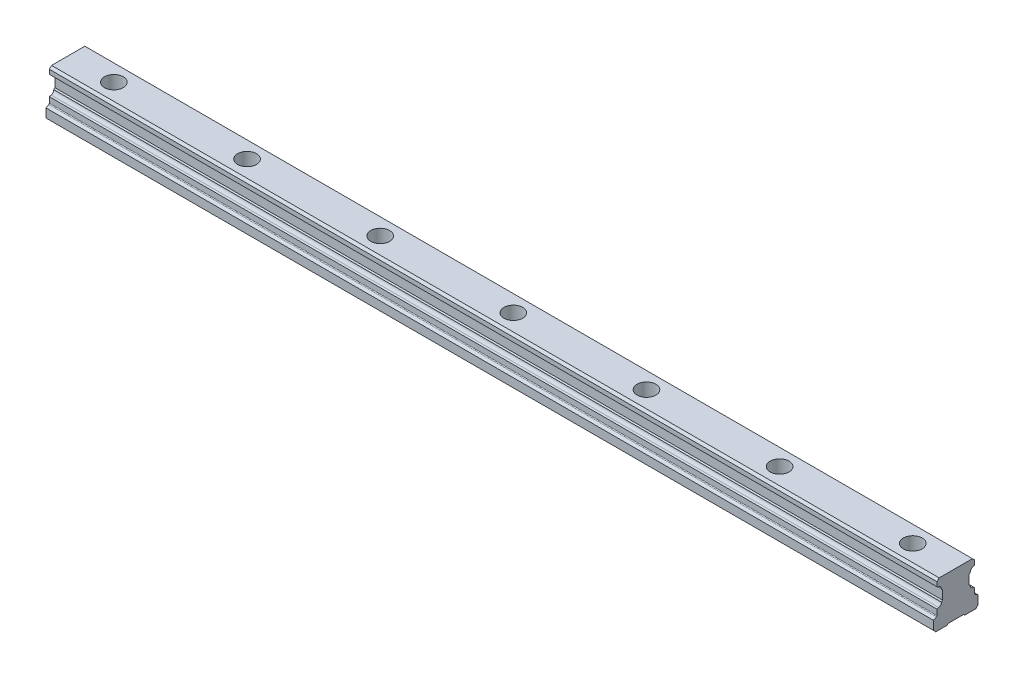
from build123d import *

# Parameters (mm, degrees)
BOSS_EXTRUDE5_DEPTH = 400
SKETCH8_R           = 4.25
CUT_EXTRUDE1_DEPTH  = 9
SKETCH9_R           = 3
CUT_EXTRUDE2_DEPTH  = 459.748231604
LPATTERN1_COUNT     = 20
LPATTERN1_PITCH     = 60


with BuildPart() as part:
    # Sketch7 → Boss-Extrude5 (new body)
    with BuildSketch(Plane(origin=(58.5, 0, 0), x_dir=(0, 0, -1), z_dir=(1, 0, 0))):
        with BuildLine():
            Line((-7.709038211, 8.883084864), (-8.5, 8.601077183))
            Line((-8.5, 8.601077183), (-8.5, 6.104700538))
            ThreePointArc((-8.5, 6.104700538), (-8.566987298, 5.854700538), (-8.75, 5.671687836))
            Line((-8.75, 5.671687836), (-10, 4.95))
            Line((-10, 4.95), (-10, 1))
            Line((-10, 1), (-9, 0))
            Line((-9, 0), (-4, 0))
            Line((-4, 0), (-3.5, 0.5))
            Line((-3.5, 0.5), (3.5, 0.5))
            Line((3.5, 0.5), (4, 0))
            Line((4, 0), (9, 0))
            Line((9, 0), (10, 1))
            Line((10, 1), (10, 4.95))
            Line((10, 4.95), (8.75, 5.671687836))
            ThreePointArc((8.75, 5.671687836), (8.566987298, 5.854700538), (8.5, 6.104700538))
            Line((8.5, 6.104700538), (8.5, 8.46691323))
            Line((8.5, 8.46691323), (8.084678947, 8.882234283))
            ThreePointArc((8.084678947, 8.882234283), (6.941822875, 9.249266637), (6.503340774, 10.366659226))
            Line((6.503340774, 10.366659226), (6, 10.87))
            Line((6, 10.87), (6, 14.93))
            Line((6, 14.93), (6.503340774, 15.433340774))
            ThreePointArc((6.503340774, 15.433340774), (6.813545517, 16.412959034), (7.709038211, 16.916915136))
            Line((7.709038211, 16.916915136), (8.5, 17.198922817))
            Line((8.5, 17.198922817), (8.5, 19.3))
            Line((8.5, 19.3), (7.5, 20.3))
            Line((7.5, 20.3), (-7.5, 20.3))
            Line((-7.5, 20.3), (-8.5, 19.3))
            Line((-8.5, 19.3), (-8.5, 17.33308677))
            Line((-8.5, 17.33308677), (-8.084678947, 16.917765717))
            ThreePointArc((-8.084678947, 16.917765717), (-6.941822875, 16.550733363), (-6.503340774, 15.433340774))
            Line((-6.503340774, 15.433340774), (-6, 14.93))
            Line((-6, 14.93), (-6, 10.87))
            Line((-6, 10.87), (-6.503340774, 10.366659226))
            ThreePointArc((-6.503340774, 10.366659226), (-6.813545517, 9.387040966), (-7.709038211, 8.883084864))
        make_face()
    extrude(amount=BOSS_EXTRUDE5_DEPTH)

    # Sketch8 → Cut-Extrude1 (cut)
    with BuildSketch(Plane(origin=(0, 20.3, 0), x_dir=(1, 0, 0), z_dir=(0, 1, 0))):
        with Locations(Location((79.1, 0, 0), (0, 0, 270))):
            Circle(SKETCH8_R)
    cut_extrude1 = extrude(amount=-CUT_EXTRUDE1_DEPTH, mode=Mode.SUBTRACT)

    # Sketch9 → Cut-Extrude2 (cut, through all)
    with BuildSketch(Plane(origin=(0, 11.3, 0), x_dir=(1, 0, 0), z_dir=(0, 1, 0))):
        with Locations(Location((79.1, 0, 0), (0, 0, 270))):
            Circle(SKETCH9_R)
    cut_extrude2 = extrude(amount=-CUT_EXTRUDE2_DEPTH, mode=Mode.SUBTRACT)

    # LPattern1: Cut-Extrude1, Cut-Extrude2 ×20
    with Locations(*[(i * LPATTERN1_PITCH, 0, 0) for i in range(1, LPATTERN1_COUNT)]):
        add(cut_extrude1, mode=Mode.SUBTRACT)
        add(cut_extrude2, mode=Mode.SUBTRACT)


solid = part.part
